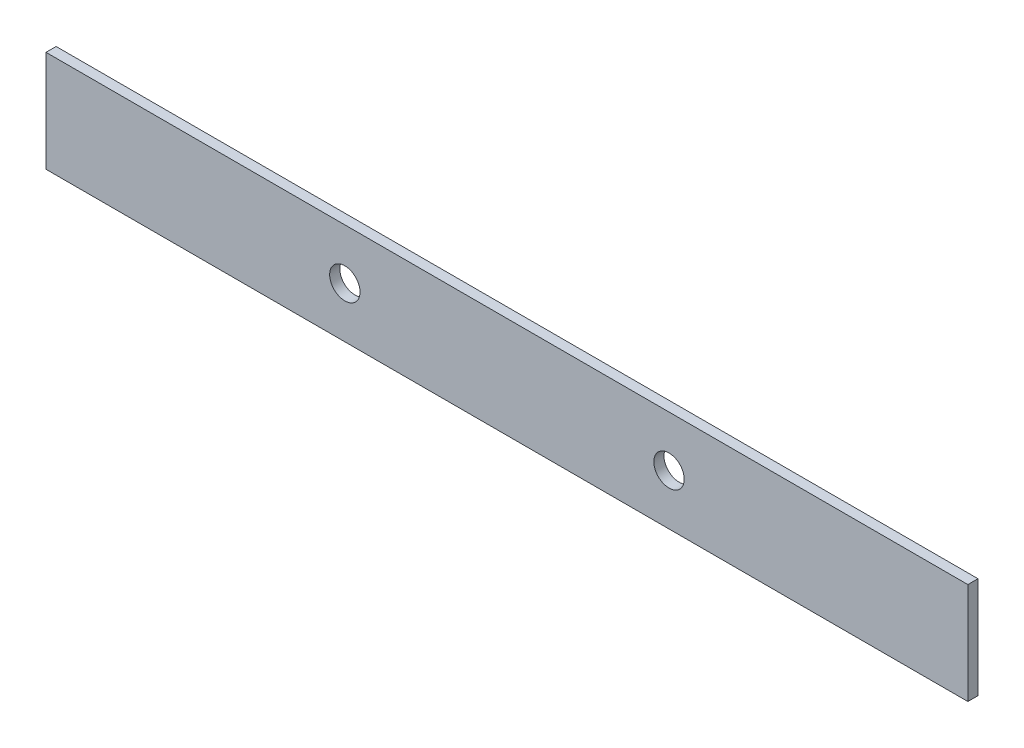
from build123d import *

# Parameters (mm, degrees)
ESQUISSE1_W        = 910
ESQUISSE1_H        = 100
ESQUISSE1_R        = 15
BOSS_EXTRU_1_DEPTH = 10


with BuildPart() as part:
    # Esquisse1 → Boss.-Extru.1 (new body)
    with BuildSketch(Plane.XY):
        with Locations((455, 50)):
            Rectangle(ESQUISSE1_W, ESQUISSE1_H)
        with Locations((295, 50)):
            Circle(ESQUISSE1_R, mode=Mode.SUBTRACT)
        with Locations(Location((615, 50, 0), (0, 0, 180))):
            Circle(ESQUISSE1_R, mode=Mode.SUBTRACT)
    extrude(amount=BOSS_EXTRU_1_DEPTH)


solid = part.part
